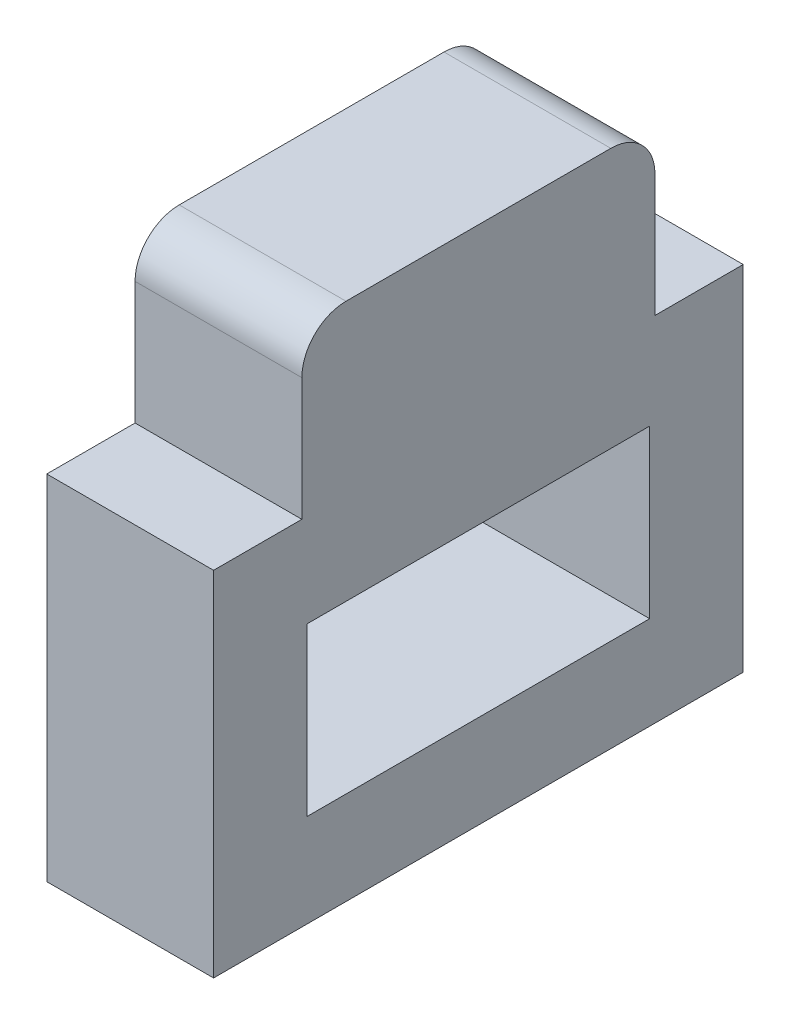
from build123d import *

# Parameters (mm, degrees)
SKETCH1_W           = 19.05
SKETCH1_H           = 12.7
BOSS_EXTRUDE1_DEPTH = 3
SKETCH2_W           = 6
SKETCH2_H           = 12.7
BOSS_EXTRUDE2_DEPTH = 6
SKETCH3_W           = 12.319
SKETCH3_H           = 5.999999938
CUT_EXTRUDE1_DEPTH  = 17.710718865
FILLET1_R           = 1.5875


with BuildPart() as part:
    # Sketch1 → Boss-Extrude1 (new, symmetric)
    with BuildSketch(Plane(origin=(0, 0, 0), x_dir=(0, 0, -1), z_dir=(1, 0, 0))):
        Rectangle(SKETCH1_W, SKETCH1_H)
    extrude(amount=BOSS_EXTRUDE1_DEPTH, both=True)

    # Sketch2 → Boss-Extrude2 (add)
    with BuildSketch(Plane(origin=(0, 6.35, 0), x_dir=(1, 0, 0), z_dir=(0, 1, 0))):
        Rectangle(SKETCH2_W, SKETCH2_H)
    extrude(amount=BOSS_EXTRUDE2_DEPTH)

    # Sketch3 → Cut-Extrude1 (cut, through all)
    with BuildSketch(Plane(origin=(3, 0, 0), x_dir=(0, 0, -1), z_dir=(1, 0, 0))):
        Rectangle(SKETCH3_W, SKETCH3_H)
    extrude(amount=-CUT_EXTRUDE1_DEPTH, mode=Mode.SUBTRACT)

    # Fillet1
    fillet1_edges = [part.edges().sort_by_distance(p)[0] for p in [
        (0, 12.35, -6.35),
        (0, 12.35, 6.35),
    ]]
    fillet(fillet1_edges, radius=FILLET1_R)


solid = part.part
